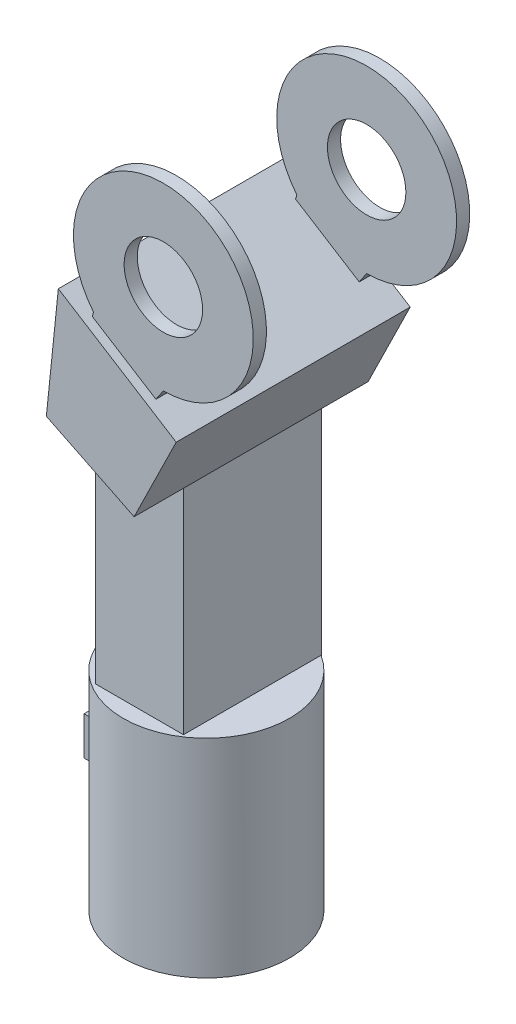
from build123d import *

# Parameters (mm, degrees)
BOSS_EXTRUDE1_START      = -0.143
SKETCH1_R                = 0.028440267
BOSS_EXTRUDE1_DEPTH      = 0.071
SKETCH2_W                = 0.015839442
SKETCH2_H                = 0.013131845
BOSS_EXTRUDE2_DEPTH      = 0.056
BOSS_EXTRUDE3_START      = -0.007
SKETCH3_W                = 0.047113502
SKETCH3_H                = 0.095471257
BOSS_EXTRUDE3_DEPTH      = 0.03
BOSS_EXTRUDE4_DEPTH      = 0.04
BOSS_EXTRUDE4_DEPTH_BACK = 0.04
BOSS_EXTRUDE5_START      = 0.0325
SKETCH6_R                = 0.013410772
BOSS_EXTRUDE5_DEPTH      = 0.0045
BOSS_EXTRUDE6_START      = -0.037
SKETCH6_3_R              = 0.013410772
BOSS_EXTRUDE6_DEPTH      = 0.0045


with BuildPart() as part:
    # Sketch1 → Boss-Extrude1 (new body)
    with BuildSketch(Plane(origin=(0, 0, 0), x_dir=(1, 0, 0), z_dir=(0, 1, 0)).offset(BOSS_EXTRUDE1_START)):
        with Locations((-0.022155362, -0.000154163)):
            Circle(SKETCH1_R)
    extrude(amount=-BOSS_EXTRUDE1_DEPTH)

    # Sketch2 → Boss-Extrude2 (add)
    with BuildSketch(Plane(origin=(0, 0, 0), x_dir=(0, 0, -1), z_dir=(1, 0, 0))):
        with Locations((-0.000180717, -0.175372091)):
            Rectangle(SKETCH2_W, SKETCH2_H)
    extrude(amount=-BOSS_EXTRUDE2_DEPTH)

    # Sketch3 → Boss-Extrude3 (add)
    with BuildSketch(Plane(origin=(0, 0, 0), x_dir=(0, 0, -1), z_dir=(1, 0, 0)).offset(BOSS_EXTRUDE3_START)):
        with Locations((0.000437164, -0.097977702)):
            Rectangle(SKETCH3_W, SKETCH3_H)
    extrude(amount=-BOSS_EXTRUDE3_DEPTH)

    # Sketch4 → Boss-Extrude4 (add, two sides: drawn at the far end of the back side and taken through both)
    with BuildSketch(Plane.XY.offset(-BOSS_EXTRUDE4_DEPTH_BACK)):
        Polygon((0.007393718, -0.040743365), (-0.007, -0.070024242), (-0.037, -0.055277022), (-0.032908503, -0.01546525), align=None)
    extrude(amount=BOSS_EXTRUDE4_DEPTH + BOSS_EXTRUDE4_DEPTH_BACK)

    # Sketch6 → Boss-Extrude5 (add)
    with BuildSketch(Plane.XY.offset(BOSS_EXTRUDE5_START)):
        with BuildLine():
            Line((-0.024284044, -0.020874631), (-0.023880316, -0.019364786))
            ThreePointArc((-0.023880316, -0.019364786), (0.013226699, 0.027754618), (0, -0.030745152))
            Line((0, -0.030745152), (-0.002547697, -0.034507971))
            Line((-0.002547697, -0.034507971), (-0.024284044, -0.020874631))
        make_face()
        Circle(SKETCH6_R, mode=Mode.SUBTRACT)
    extrude(amount=BOSS_EXTRUDE5_DEPTH)

    # Sketch6<3> → Boss-Extrude6 (add)
    with BuildSketch(Plane.XY.offset(BOSS_EXTRUDE6_START)):
        with BuildLine():
            Line((-0.024284044, -0.020874631), (-0.023880316, -0.019364786))
            ThreePointArc((-0.023880316, -0.019364786), (0.013226699, 0.027754618), (0, -0.030745152))
            Line((0, -0.030745152), (-0.002547697, -0.034507971))
            Line((-0.002547697, -0.034507971), (-0.024284044, -0.020874631))
        make_face()
        Circle(SKETCH6_3_R, mode=Mode.SUBTRACT)
    extrude(amount=BOSS_EXTRUDE6_DEPTH)


solid = part.part
